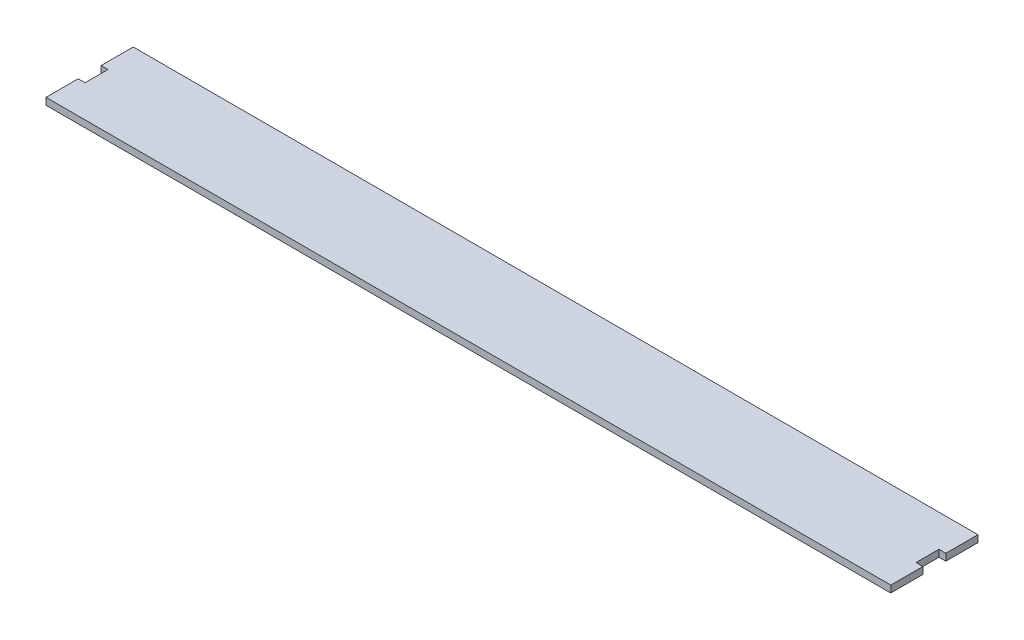
from build123d import *

# Parameters (mm, degrees)
BOSS_EXTRUDE1_DEPTH = 3


with BuildPart() as part:
    # Sketch1 → Boss-Extrude1 (new body)
    with BuildSketch(Plane(origin=(0, 0, 0), x_dir=(1, 0, 0), z_dir=(0, 1, 0))):
        Polygon((184, 19), (-184, 19), (-184, 5), (-181, 5), (-181, -5), (-184, -5), (-184, -19), (184, -19), (184, -5), (181, -5), (181, 5), (184, 5), align=None)
    extrude(amount=BOSS_EXTRUDE1_DEPTH)


solid = part.part
